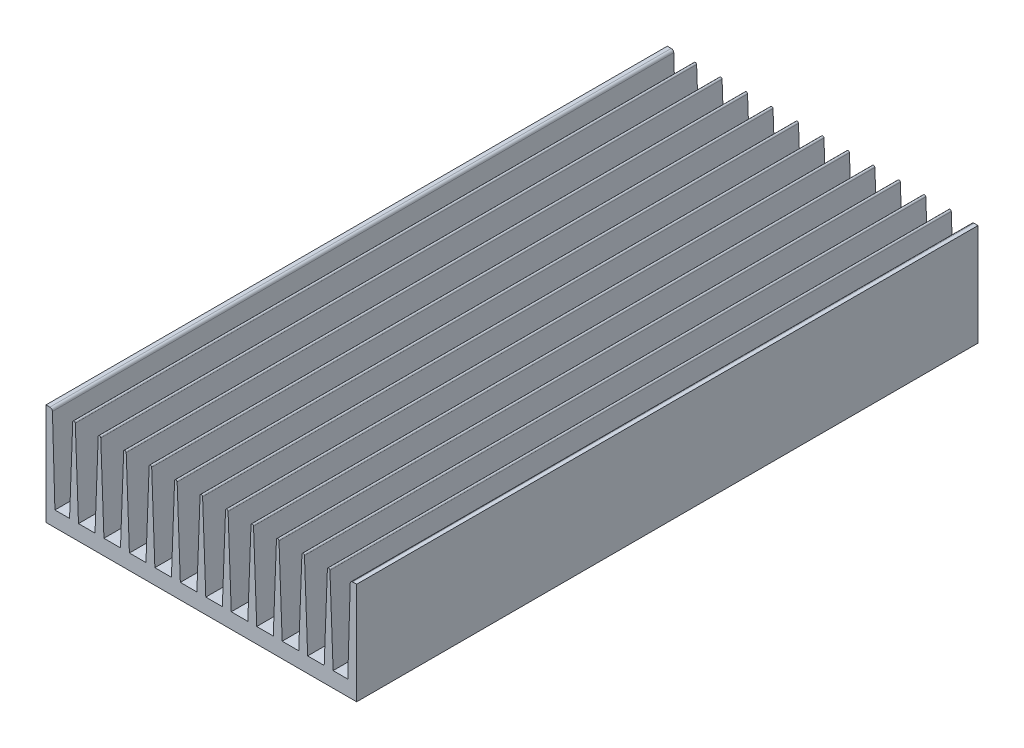
from build123d import *

# Parameters (mm, degrees)
EXTRUDE_1_DEPTH       = 244
EXTRUDE_3_DEPTH       = 244
PATTERN_CURVE_1_COUNT = 11
PATTERN_CURVE_1_PITCH = 10
SKETCH_3_R            = 2.25
CUT_EXTRUDE_1_DEPTH   = 6
SKETCH_4_R            = 1.6
SKETCH_4_R_2          = 1.15
CUT_EXTRUDE_2_DEPTH   = 6


with BuildPart() as part:
    # Эскиз1 → Вытянуть1 (new body)
    with BuildSketch(Plane.XY):
        with BuildLine():
            Line((0, 40), (1.528979332, 40))
            ThreePointArc((1.528979332, 40), (2.225614441, 39.717425624), (2.528547087, 39.029399052))
            Line((2.528547087, 39.029399052), (3.5, 6))
            Line((3.5, 6), (118.5, 6))
            Line((118.5, 6), (119.471452913, 39.029399052))
            ThreePointArc((119.471452913, 39.029399052), (119.774385559, 39.717425624), (120.471020668, 40))
            Line((120.471020668, 40), (122, 40))
            Line((122, 40), (122, 0))
            Line((122, 0), (0, 0))
            Line((0, 0), (0, 40))
        make_face()
    extrude(amount=EXTRUDE_1_DEPTH)

    # Эскиз2 → Вытянуть3 (add)
    with BuildSketch(Plane.XY.offset(244)):
        with BuildLine():
            Line((10.5, 39.5), (9.25, 6))
            Line((9.25, 6), (12.75, 6))
            Line((12.75, 6), (11.5, 39.5))
            ThreePointArc((11.5, 39.5), (11, 40), (10.5, 39.5))
        make_face()
    extrude_3 = extrude(amount=-EXTRUDE_3_DEPTH)

    # Кривая1: Вытянуть3 ×11
    with Locations(*[(i * PATTERN_CURVE_1_PITCH, 0, 0) for i in range(1, PATTERN_CURVE_1_COUNT)]):
        add(extrude_3)

    # Эскиз3 → Вырез-Вытянуть1 (cut)
    with BuildSketch(Plane.XZ):
        with Locations((26, 236)):
            Circle(SKETCH_3_R)
        with Locations((96, 236)):
            Circle(SKETCH_3_R)
        with Locations(Location((96, 8, 0), (0, 0, 180))):
            Circle(SKETCH_3_R)
        with Locations(Location((26, 8, 0), (0, 0, 180))):
            Circle(SKETCH_3_R)
    extrude(amount=-CUT_EXTRUDE_1_DEPTH, mode=Mode.SUBTRACT)

    # Эскиз4 → Вырез-Вытянуть2 (cut)
    with BuildSketch(Plane(origin=(133.240090243, 0, 310.149074448), x_dir=(-1, 0, 0), z_dir=(0, -1, 0))):
        with Locations(Location((48.740090243, 89.149074448, 0), (0, 0, 180))):
            Circle(SKETCH_4_R)
        with Locations(Location((48.740090243, 229.149074448, 0), (0, 0, 180))):
            Circle(SKETCH_4_R)
        with Locations((8.990090243, 225.549074448)):
            Circle(SKETCH_4_R)
        with Locations(Location((66.510090243, 102.149074448, 0), (0, 0, 180))):
            Circle(SKETCH_4_R_2)
        with Locations(Location((81.740090243, 187.149074448, 0), (0, 0, 180))):
            Circle(SKETCH_4_R)
        with Locations(Location((91.240090243, 288.149074448, 0), (0, 0, 180))):
            Circle(SKETCH_4_R)
        with Locations(Location((91.240090243, 240.149074448, 0), (0, 0, 180))):
            Circle(SKETCH_4_R)
        with Locations(Location((25.240090243, 240.149074448, 0), (0, 0, 180))):
            Circle(SKETCH_4_R)
        with Locations(Location((25.240090243, 288.149074448, 0), (0, 0, 180))):
            Circle(SKETCH_4_R)
        with Locations(Location((81.740090243, 168.149074448, 0), (0, 0, 180))):
            Circle(SKETCH_4_R)
    extrude(amount=-CUT_EXTRUDE_2_DEPTH, mode=Mode.SUBTRACT)


solid = part.part
